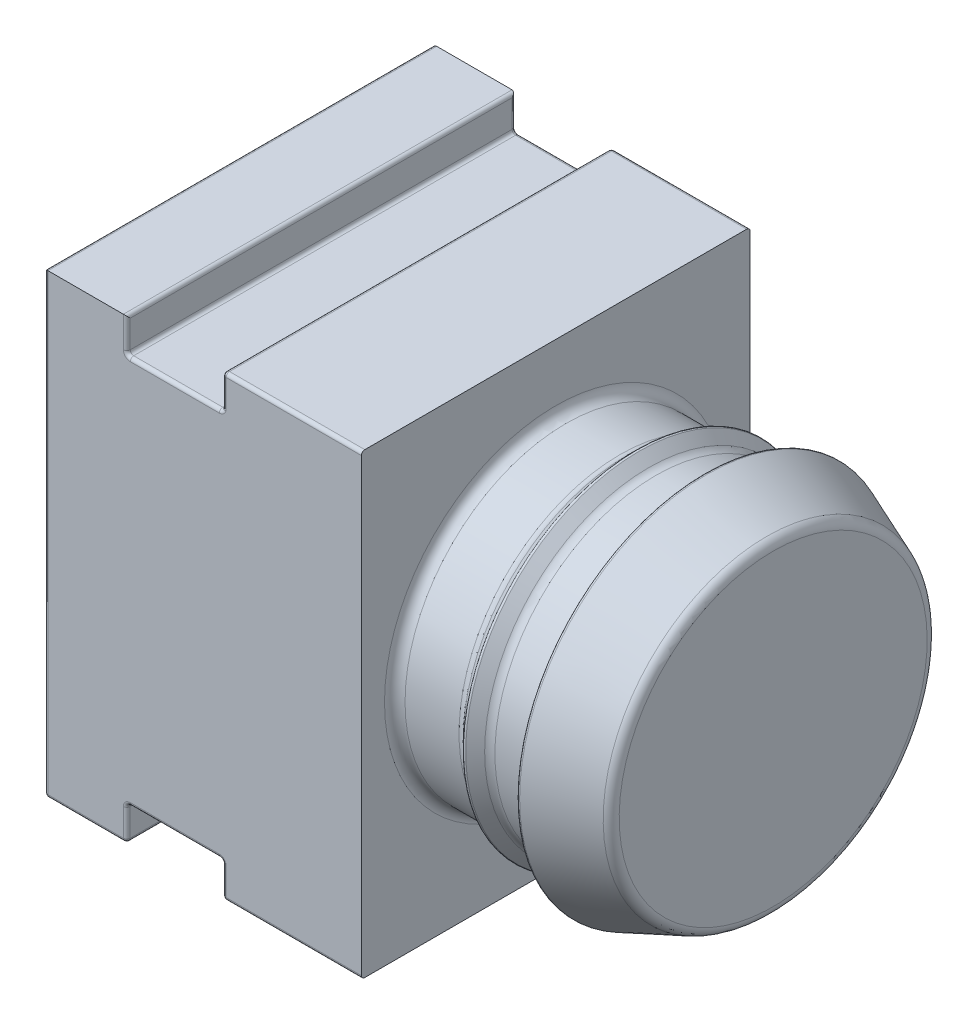
from build123d import *

# Parameters (mm, degrees)
SKETCH2_W           = 18.5
SKETCH2_H           = 22.7
SKETCH2_R           = 3.175
BOSS_EXTRUDE2_DEPTH = 11.35
SKETCH12_R          = 3.175
BOSS_EXTRUDE3_DEPTH = 22.7
SKETCH13_W          = 18.5
SKETCH13_H          = 22.7
BOSS_EXTRUDE4_DEPTH = 2
SKETCH15_W          = 5.6
SKETCH15_H          = 2
CUT_EXTRUDE1_DEPTH  = 33.183264284
FILLET1_R           = 0.1
FILLET2_R           = 0.6
FILLET5_R           = 0.2


with BuildPart() as part:
    # Sketch2 → Boss-Extrude2 (new, symmetric)
    with BuildSketch(Plane(origin=(0, 0, 0), x_dir=(1, 0, 0), z_dir=(0, 1, 0))):
        with Locations((-9.25, 0)):
            Rectangle(SKETCH2_W, SKETCH2_H)
        with Locations(Location((-12.7, 0, 0), (0, 0, 270))):
            Circle(SKETCH2_R, mode=Mode.SUBTRACT)
    extrude(amount=BOSS_EXTRUDE2_DEPTH, both=True)

    # Sketch3 → Revolve1 (revolve)
    with BuildSketch(Plane.XY):
        Polygon((0, 0), (0, 9.4), (4, 9.4), (4.8, 10.2), (5.6, 9.4), (8.7, 9.4), (8.7, 11), (12.7, 9.4), (12.7, 0), align=None)
    revolve(axis=Axis((12.7, 0, 0), (-1, 0, 0)))

    # Sketch12 → Boss-Extrude3 (add)
    with BuildSketch(Plane.XZ.offset(11.35)):
        with Locations((-12.7, 0)):
            Circle(SKETCH12_R)
    extrude(amount=-BOSS_EXTRUDE3_DEPTH)

    # Sketch13 → Boss-Extrude4 (add)
    with BuildSketch(Plane.XZ.offset(11.35)):
        with Locations((-9.25, 0)):
            Rectangle(SKETCH13_W, SKETCH13_H)
    boss_extrude4 = extrude(amount=BOSS_EXTRUDE4_DEPTH)

    # Mirror1: Boss-Extrude4 across plane
    add(boss_extrude4.mirror(Plane.ZX))

    # Sketch15 → Cut-Extrude1 (cut, through all)
    with BuildSketch(Plane(origin=(0, 0, -11.35), x_dir=(-1, 0, 0), z_dir=(0, 0, -1))):
        with Locations((10.9, 12.35)):
            Rectangle(SKETCH15_W, SKETCH15_H)
        with Locations((10.9, -12.35)):
            Rectangle(SKETCH15_W, SKETCH15_H)
    extrude(amount=-CUT_EXTRUDE1_DEPTH, mode=Mode.SUBTRACT)

    # Fillet1
    fillet1_edges = [part.edges().sort_by_distance(p)[0] for p in [
        (8.7, -11, 0),
        (4.8, -10.2, 0),
    ]]
    fillet(fillet1_edges, radius=FILLET1_R)

    # Fillet2
    fillet2_edges = [part.edges().sort_by_distance(p)[0] for p in [
        (0, -9.4, 0),
        (5.6, -9.4, 0),
        (8.7, -9.4, 0),
        (12.7, -9.4, 0),
        (4, -9.4, 0),
    ]]
    fillet(fillet2_edges, radius=FILLET2_R)

    # Fillet5
    fillet5_edges = [part.edges().sort_by_distance(p)[0] for p in [
        (-4.05, -13.35, 11.35),
        (-18.5, -13.35, 0),
        (-16.1, -13.35, -11.35),
        (-18.5, 13.35, 0),
        (-4.05, 13.35, 11.35),
        (-4.05, 13.35, -11.35),
        (-16.1, -13.35, 11.35),
        (-4.05, -13.35, -11.35),
        (-8.1, 12.35, 11.35),
        (-8.1, 11.35, 0),
        (-8.1, 13.35, 0),
        (-13.7, 12.35, 11.35),
        (-13.7, 13.35, 0),
        (-10.9, 11.35, 11.35),
        (-13.7, 11.35, 0),
        (-8.1, 12.35, -11.35),
        (-10.9, 11.35, -11.35),
        (-13.7, 12.35, -11.35),
        (-13.7, -13.35, 0),
        (-8.1, -12.35, 11.35),
        (-8.1, -13.35, 0),
        (-10.9, -11.35, 11.35),
        (-8.1, -11.35, 0),
        (-13.7, -12.35, 11.35),
        (-13.7, -11.35, 0),
        (-13.7, -12.35, -11.35),
        (-10.9, -11.35, -11.35),
        (-8.1, -12.35, -11.35),
        (-18.5, 0, 11.35),
        (-18.5, 0, -11.35),
    ]]
    fillet(fillet5_edges, radius=FILLET5_R)


solid = part.part
